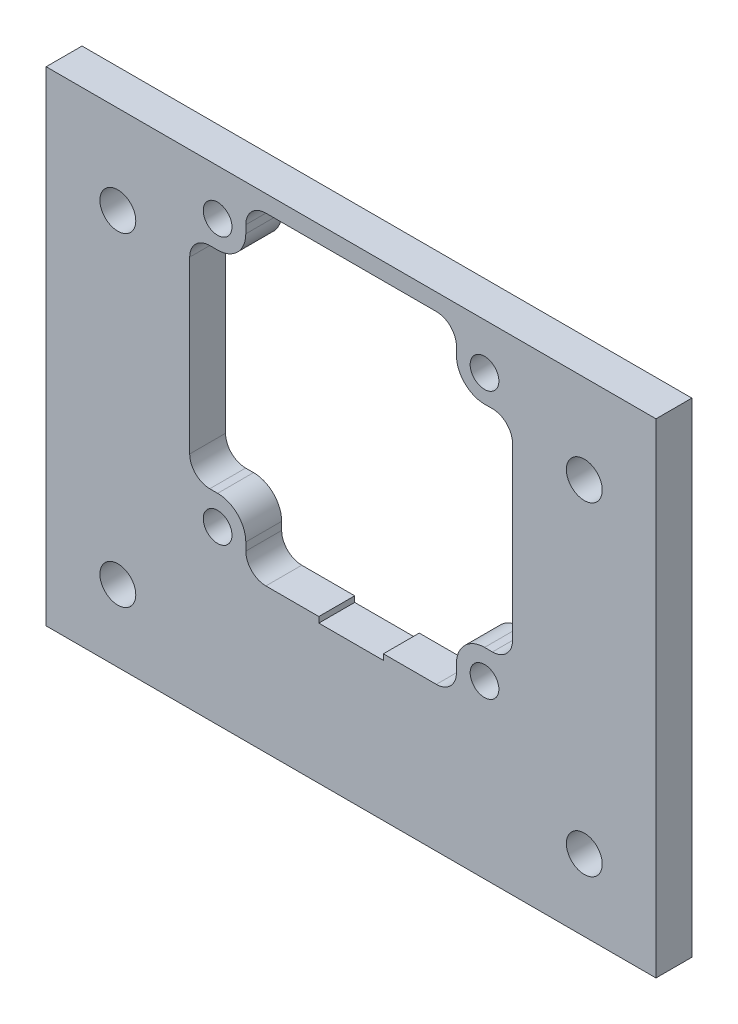
from build123d import *

# Parameters (mm, degrees)
SKETCH1_W           = 107.95
SKETCH1_H           = 31.75
SKETCH1_H_2         = 53.975
BOSS_EXTRUDE1_DEPTH = 6.35
SKETCH11_R          = 2.54
CUT_EXTRUDE2_DEPTH  = 7.62
SKETCH12_W          = 11.43
SKETCH12_H          = 1.016
CUT_EXTRUDE3_DEPTH  = 7.62
SKETCH13_R          = 3.175
CUT_EXTRUDE4_DEPTH  = 7.62


with BuildPart() as part:
    # Sketch1 → Boss-Extrude1 (new body)
    with BuildSketch(Plane.XY):
        with Locations((0, 15.875)):
            Rectangle(SKETCH1_W, SKETCH1_H)
        with Locations((0, -26.9875)):
            Rectangle(SKETCH1_W, SKETCH1_H_2)
    extrude(amount=BOSS_EXTRUDE1_DEPTH)

    # Sketch11 → Cut-Extrude2 (cut)
    with BuildSketch(Plane(origin=(0, 0, 0), x_dir=(-1, 0, 0), z_dir=(0, 0, -1))):
        with Locations((23.622, -23.622)):
            Circle(SKETCH11_R)
        with Locations((-23.622, -23.622)):
            Circle(SKETCH11_R)
        with Locations((-23.622, 23.622)):
            Circle(SKETCH11_R)
        with Locations((23.622, 23.622)):
            Circle(SKETCH11_R)
    extrude(amount=-CUT_EXTRUDE2_DEPTH, mode=Mode.SUBTRACT)

    # Sketch12 → Cut-Extrude3 (cut)
    with BuildSketch(Plane(origin=(0, 0, 0), x_dir=(-1, 0, 0), z_dir=(0, 0, -1))):
        with BuildLine():
            ThreePointArc((-25.027545804, -18.46622785), (-27.542017518, -17.424699564), (-28.583545804, -14.91022785))
            Line((-28.583545804, -14.91022785), (-28.583545804, 15.26497215))
            ThreePointArc((-28.583545804, 15.26497215), (-27.542017518, 17.779443863), (-25.027545804, 18.82097215))
            Line((-25.027545804, 18.82097215), (-23.630545804, 18.82097215))
            ThreePointArc((-23.630545804, 18.82097215), (-20.110285404, 20.27911175), (-18.652145804, 23.79937215))
            Line((-18.652145804, 23.79937215), (-18.652145804, 25.19637215))
            ThreePointArc((-18.652145804, 25.19637215), (-17.610617518, 27.710843863), (-15.096145804, 28.75237215))
            Line((-15.096145804, 28.75237215), (15.079054196, 28.75237215))
            ThreePointArc((15.079054196, 28.75237215), (17.59352591, 27.710843863), (18.635054196, 25.19637215))
            Line((18.635054196, 25.19637215), (18.635054196, 23.79937215))
            ThreePointArc((18.635054196, 23.79937215), (20.093193797, 20.27911175), (23.613454196, 18.82097215))
            Line((23.613454196, 18.82097215), (25.010454196, 18.82097215))
            ThreePointArc((25.010454196, 18.82097215), (27.52492591, 17.779443863), (28.566454196, 15.26497215))
            Line((28.566454196, 15.26497215), (28.566454196, -14.91022785))
            ThreePointArc((28.566454196, -14.91022785), (27.52492591, -17.424699564), (25.010454196, -18.46622785))
            Line((25.010454196, -18.46622785), (23.613454196, -18.46622785))
            ThreePointArc((23.613454196, -18.46622785), (20.093193797, -19.924367451), (18.635054196, -23.44462785))
            Line((18.635054196, -23.44462785), (18.635054196, -24.84162785))
            ThreePointArc((18.635054196, -24.84162785), (17.59352591, -27.356099564), (15.079054196, -28.39762785))
            Line((15.079054196, -28.39762785), (-15.096145804, -28.39762785))
            ThreePointArc((-15.096145804, -28.39762785), (-17.610617518, -27.356099564), (-18.652145804, -24.84162785))
            Line((-18.652145804, -24.84162785), (-18.652145804, -23.44462785))
            ThreePointArc((-18.652145804, -23.44462785), (-20.110285404, -19.924367451), (-23.630545804, -18.46622785))
            Line((-23.630545804, -18.46622785), (-25.027545804, -18.46622785))
        make_face()
        with Locations((-0.008545804, -28.90562785)):
            Rectangle(SKETCH12_W, SKETCH12_H)
    extrude(amount=-CUT_EXTRUDE3_DEPTH, mode=Mode.SUBTRACT)

    # Sketch13 → Cut-Extrude4 (cut)
    with BuildSketch(Plane(origin=(0, 0, 0), x_dir=(-1, 0, 0), z_dir=(0, 0, -1))):
        with Locations((-41.283545804, 16.05237215)):
            Circle(SKETCH13_R)
        with Locations((-41.283545804, -41.275)):
            Circle(SKETCH13_R)
        with Locations(Location((41.283545804, -41.275, 0), (0, 0, 180))):
            Circle(SKETCH13_R)
        with Locations(Location((41.283545804, 16.05237215, 0), (0, 0, 180))):
            Circle(SKETCH13_R)
    extrude(amount=-CUT_EXTRUDE4_DEPTH, mode=Mode.SUBTRACT)


solid = part.part
